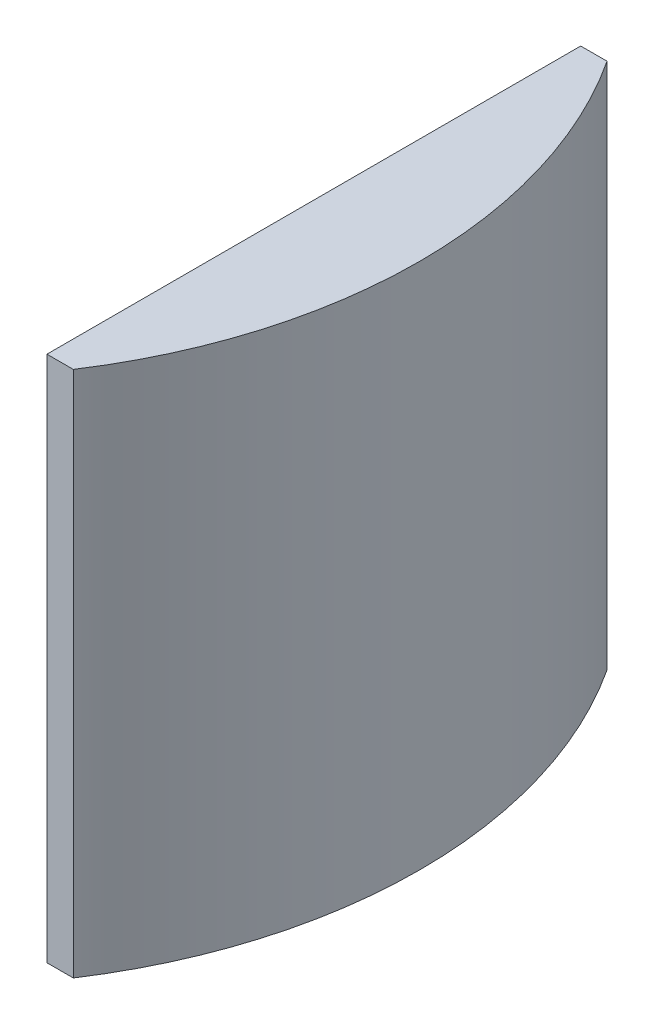
from build123d import *

# Parameters (mm, degrees)
EXTRUDE_1_DEPTH = 20
SKETCH_2_W      = 20.253995302
SKETCH_2_H      = 20
EXTRUDE_2_DEPTH = 1


with BuildPart() as part:
    # 草图1 → 凸台-拉伸1 (new body)
    with BuildSketch(Plane(origin=(0, 0, 0), x_dir=(1, 0, 0), z_dir=(0, 1, 0))):
        with BuildLine():
            ThreePointArc((1.545950546, 0), (0.774439181, 5.28408774), (-1.475680066, 10.126997651))
            Line((-1.475680066, 10.126997651), (-1.475680066, -10.126997651))
            ThreePointArc((-1.475680066, -10.126997651), (0.774439181, -5.28408774), (1.545950546, 0))
        make_face()
    extrude(amount=EXTRUDE_1_DEPTH)

    # 草图2 → 凸台-拉伸2 (add)
    with BuildSketch(Plane.ZY.offset(1.475680066)):
        with Locations((0, 10)):
            Rectangle(SKETCH_2_W, SKETCH_2_H)
    extrude(amount=EXTRUDE_2_DEPTH)


solid = part.part
